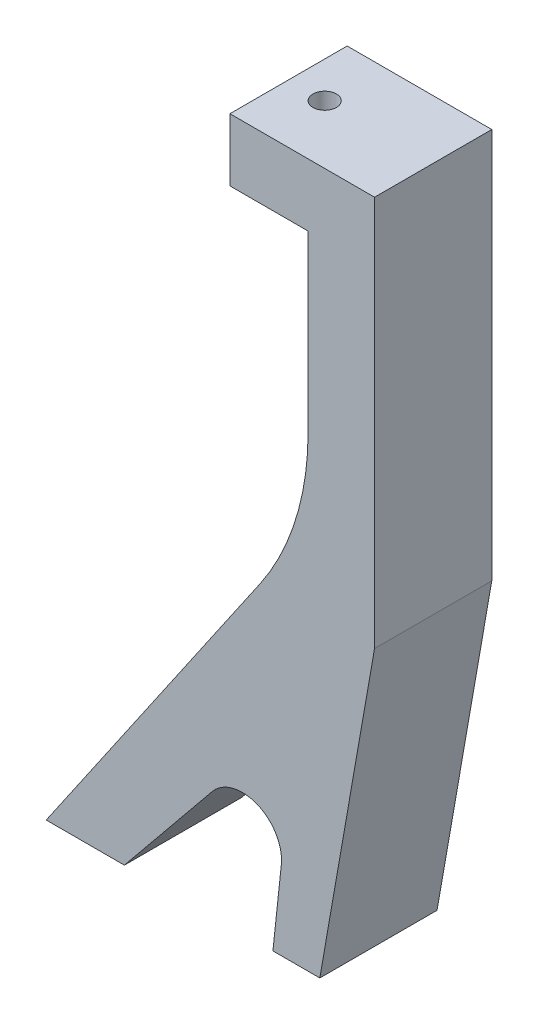
from build123d import *

# Parameters (mm, degrees)
BOSS_EXTRUDE1_DEPTH = 15
SKETCH2_R           = 1.5
CUT_EXTRUDE1_DEPTH  = 15


with BuildPart() as part:
    # Sketch1 → Boss-Extrude1 (new body)
    with BuildSketch(Plane.XY):
        with BuildLine():
            Line((-11, 42), (-6.5, 42))
            Line((-6.5, 42), (-6.5, 19.663584609))
            ThreePointArc((-6.5, 19.663584609), (-8.071080696, 9.29500929), (-12.643277381, -0.1427164))
            Line((-12.643277381, -0.1427164), (-40, -40))
            Line((-40, -40), (-30, -40))
            Line((-30, -40), (-18.772519607, -26.233092947))
            ThreePointArc((-18.772519607, -26.233092947), (-12.972906424, -24.778489823), (-9.925888036, -29.923104703))
            Line((-9.925888036, -29.923104703), (-11, -40))
            Line((-11, -40), (-5, -40))
            Line((-5, -40), (2, 0))
            Line((2, 0), (2, 30))
            Line((2, 30), (2, 50))
            Line((2, 50), (-11, 50))
            Line((-11, 50), (-16.5, 50))
            Line((-16.5, 50), (-16.5, 42))
            Line((-16.5, 42), (-11, 42))
        make_face()
    extrude(amount=BOSS_EXTRUDE1_DEPTH)

    # Sketch2 → Cut-Extrude1 (cut)
    with BuildSketch(Plane(origin=(0, 50, 0), x_dir=(1, 0, 0), z_dir=(0, 1, 0))):
        with Locations(Location((-11.875, -7.5, 0), (0, 0, 270))):
            Circle(SKETCH2_R)
    extrude(amount=-CUT_EXTRUDE1_DEPTH, mode=Mode.SUBTRACT)


solid = part.part
